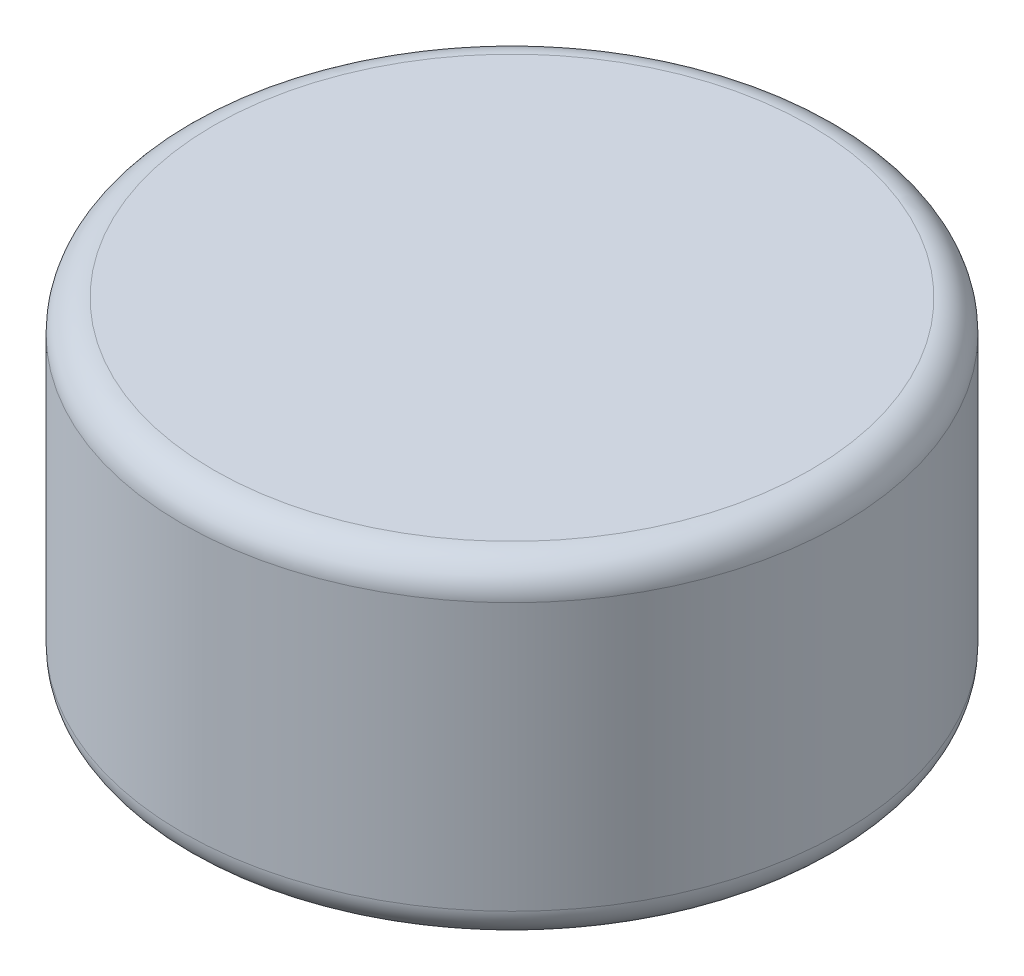
from build123d import *

# Parameters (mm, degrees)
SKETCH1_W = 3.175
SKETCH1_H = 3.175
FILLET1_R = 0.3


with BuildPart() as part:
    # Sketch1 → Revolve1 (revolve)
    with BuildSketch(Plane.XY, mode=Mode.PRIVATE) as revolve1_sk:
        with Locations((-1.5875, 1.5875)):
            Rectangle(SKETCH1_W, SKETCH1_H)
    revolve(revolve1_sk.sketch.rotate(Axis((0, 0, 0), (0, 1, 0)), 180), axis=Axis((0, 0, 0), (0, 1, 0)))

    # Fillet1
    fillet1_edges = [part.edges().sort_by_distance(p)[0] for p in [
        (-3.175, 0, 0),
        (-3.175, 3.175, 0),
    ]]
    fillet(fillet1_edges, radius=FILLET1_R)


solid = part.part
